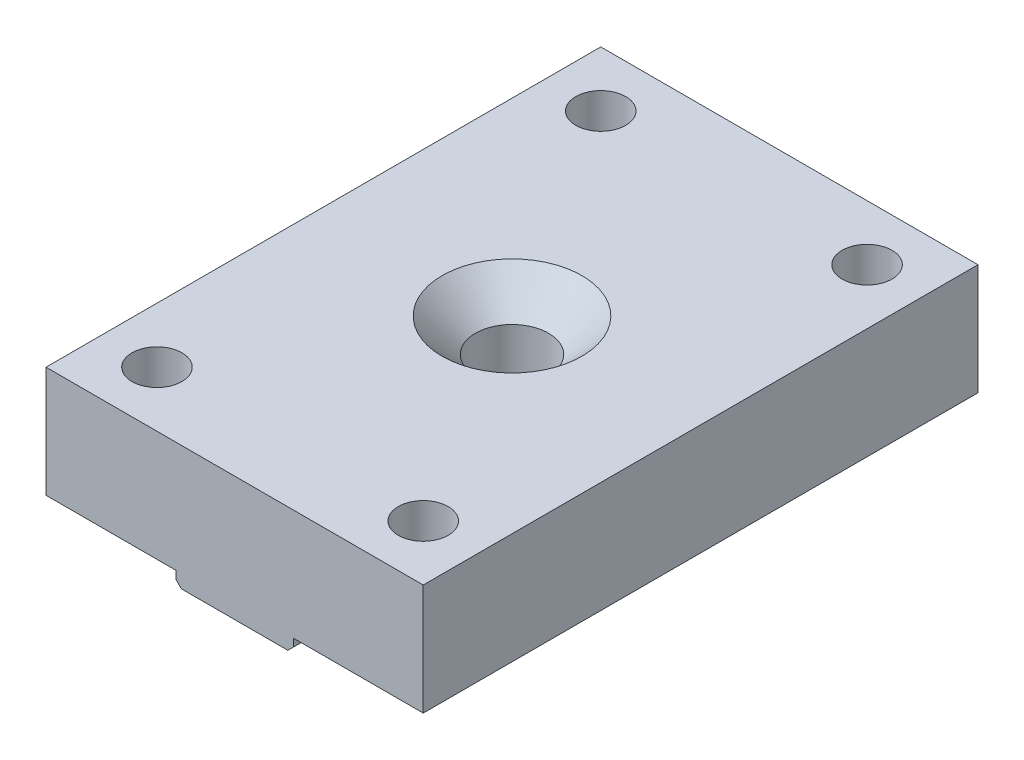
from build123d import *

# Parameters (mm, degrees)
EXTRUDE_1_DEPTH            = 50
HOLE_WIZARD_M6_D           = 6.6
HOLE_WIZARD_M6_CSINK_D     = 12.6
HOLE_WIZARD_M6_CSINK_ANGLE = 90
HOLE_WIZARD_M4_D           = 4.5
HOLE_WIZARD_M4_CSINK_D     = 9.4
HOLE_WIZARD_M4_CSINK_ANGLE = 90
CHAMFER_1_SIZE             = 0.5


with BuildPart() as part:
    # Эскиз1 → Бобышка-Вытянуть1 (new body)
    with BuildSketch(Plane.XY):
        Polygon((0, 0), (5.3, 0), (5.3, 1.2), (17, 1.2), (17, 11.2), (-17, 11.2), (-17, 1.2), (-5.3, 1.2), (-5.3, 0), align=None)
    extrude(amount=-EXTRUDE_1_DEPTH)

    # Винт M6 (through all)
    with Locations(Plane(origin=(0, 11.2, 0), x_dir=(1, 0, 0), z_dir=(0, 1, 0))):
        with Locations((0, 25)):
            CounterSinkHole(HOLE_WIZARD_M6_D / 2, HOLE_WIZARD_M6_CSINK_D / 2, counter_sink_angle=HOLE_WIZARD_M6_CSINK_ANGLE)

    # Винт M4 (through all)
    with Locations(Plane(origin=(0, 1.2, 0), x_dir=(-1, 0, 0), z_dir=(0, -1, 0))):
        with Locations((12, 5), (-12, 5), (12, 45), (-12, 45)):
            CounterSinkHole(HOLE_WIZARD_M4_D / 2, HOLE_WIZARD_M4_CSINK_D / 2, counter_sink_angle=HOLE_WIZARD_M4_CSINK_ANGLE)

    # Фаска1
    chamfer_1_edges = [part.edges().sort_by_distance(p)[0] for p in [
        (-5.3, 0, -25),
        (5.3, 0, -25),
    ]]
    chamfer(chamfer_1_edges, length=CHAMFER_1_SIZE)


solid = part.part
